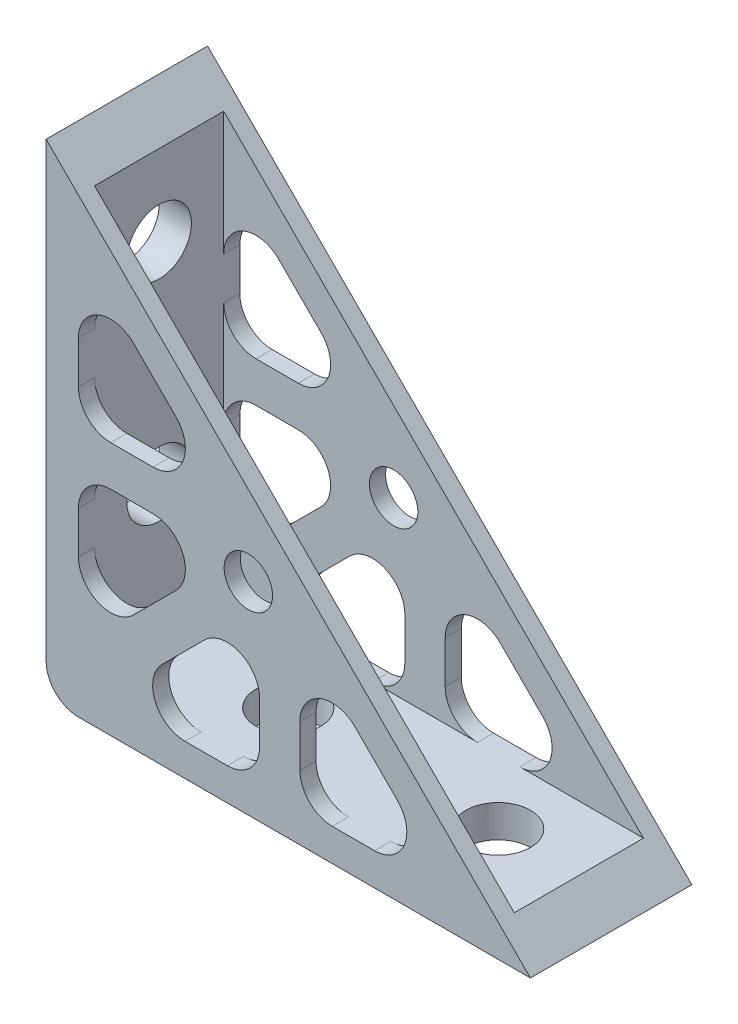
from build123d import *

# Parameters (mm, degrees)
BOSS_EXTRUDE1_DEPTH     = 10
CUT_EXTRUDE1_DEPTH      = 44.588989435
CUT_EXTRUDE1_DEPTH_BACK = 44.588989435
SKETCH2_R               = 2
CUT_EXTRUDE2_DEPTH      = 44.588989435
CUT_EXTRUDE2_DEPTH_BACK = 44.588989435
SKETCH3_R               = 2
CUT_EXTRUDE3_START      = -2
SKETCH4_W               = 27
SKETCH4_H               = 8
CUT_EXTRUDE3_DEPTH      = 42.588989435
CUT_EXTRUDE5_DEPTH      = 44.588989435
CUT_EXTRUDE5_DEPTH_BACK = 44.588989435
FILLET1_R               = 2
CUT_EXTRUDE6_DEPTH      = 44.588989435
CUT_EXTRUDE6_DEPTH_BACK = 44.588989435
SKETCH7_R               = 1.5


with BuildPart() as part:
    # Sketch1 → Boss-Extrude1 (new body)
    with BuildSketch(Plane.XY):
        Polygon((0, 0), (0, 30), (30, 0), align=None)
    extrude(amount=BOSS_EXTRUDE1_DEPTH)

    # Sketch2 → Cut-Extrude1 (cut, two sides: drawn at the far end of the back side and taken through both)
    with BuildSketch(Plane.ZY.offset(-CUT_EXTRUDE1_DEPTH_BACK)):
        with Locations(Location((5, 23, 0), (0, 0, 90))):
            Circle(SKETCH2_R)
        with Locations(Location((5, 10, 0), (0, 0, 90))):
            Circle(SKETCH2_R)
    extrude(amount=CUT_EXTRUDE1_DEPTH + CUT_EXTRUDE1_DEPTH_BACK, mode=Mode.SUBTRACT)

    # Sketch3 → Cut-Extrude2 (cut, two sides: drawn at the far end of the back side and taken through both)
    with BuildSketch(Plane.XZ.offset(-CUT_EXTRUDE2_DEPTH_BACK)):
        with Locations(Location((23, 5, 0), (0, 0, 138.590377891))):
            Circle(SKETCH3_R)
        with Locations(Location((10, 5, 0), (0, 0, 90))):
            Circle(SKETCH3_R)
    extrude(amount=CUT_EXTRUDE2_DEPTH + CUT_EXTRUDE2_DEPTH_BACK, mode=Mode.SUBTRACT)

    # Sketch4 → Cut-Extrude3 (cut, through all)
    with BuildSketch(Plane.XZ.offset(CUT_EXTRUDE3_START)):
        with Locations((15.5, 5)):
            Rectangle(SKETCH4_W, SKETCH4_H)
    extrude(amount=-CUT_EXTRUDE3_DEPTH, mode=Mode.SUBTRACT)

    # Sketch6 → Cut-Extrude5 (cut, two sides: drawn at the far end of the back side and taken through both)
    with BuildSketch(Plane(origin=(0, 0, 0), x_dir=(-1, 0, 0), z_dir=(0, 0, -1)).offset(-CUT_EXTRUDE5_DEPTH_BACK)):
        Polygon((-25.171572875, 2), (-15.719669914, 11.451902961), (-15.719669914, 2), align=None)
        Polygon((-2, 25.171572875), (-2, 15.719669914), (-11.451902961, 15.719669914), align=None)
        Polygon((-3.767766953, 2), (-13.219669914, 2), (-13.219669914, 11.451902961), align=None)
        Polygon((-2, 3.767766953), (-11.451902961, 13.219669914), (-2, 13.219669914), align=None)
    extrude(amount=CUT_EXTRUDE5_DEPTH + CUT_EXTRUDE5_DEPTH_BACK, mode=Mode.SUBTRACT)

    # Fillet1
    fillet1_edges = [part.edges().sort_by_distance(p)[0] for p in [
        (2, 13.219669914, 0.5),
        (2, 13.219669914, 9.5),
        (2, 3.767766953, 0.5),
        (2, 3.767766953, 9.5),
        (11.451902961, 13.219669914, 0.5),
        (11.451902961, 13.219669914, 9.5),
        (3.767766953, 2, 0.5),
        (3.767766953, 2, 9.5),
        (13.219669914, 11.451902961, 0.5),
        (13.219669914, 11.451902961, 9.5),
        (13.219669914, 2, 0.5),
        (13.219669914, 2, 9.5),
        (2, 25.171572875, 0.5),
        (2, 25.171572875, 9.5),
        (11.451902961, 15.719669914, 0.5),
        (11.451902961, 15.719669914, 9.5),
        (2, 15.719669914, 0.5),
        (2, 15.719669914, 9.5),
        (0, 0, 5),
        (15.719669914, 2, 0.5),
        (15.719669914, 2, 9.5),
        (25.171572875, 2, 0.5),
        (25.171572875, 2, 9.5),
        (15.719669914, 11.451902961, 0.5),
        (15.719669914, 11.451902961, 9.5),
    ]]
    fillet(fillet1_edges, radius=FILLET1_R)

    # Sketch7 → Cut-Extrude6 (cut, two sides: drawn at the far end of the back side and taken through both)
    with BuildSketch(Plane(origin=(0, 0, 0), x_dir=(-1, 0, 0), z_dir=(0, 0, -1)).offset(-CUT_EXTRUDE6_DEPTH_BACK)):
        with Locations((-12.525126266, 12.525126266)):
            Circle(SKETCH7_R)
    extrude(amount=CUT_EXTRUDE6_DEPTH + CUT_EXTRUDE6_DEPTH_BACK, mode=Mode.SUBTRACT)


solid = part.part
